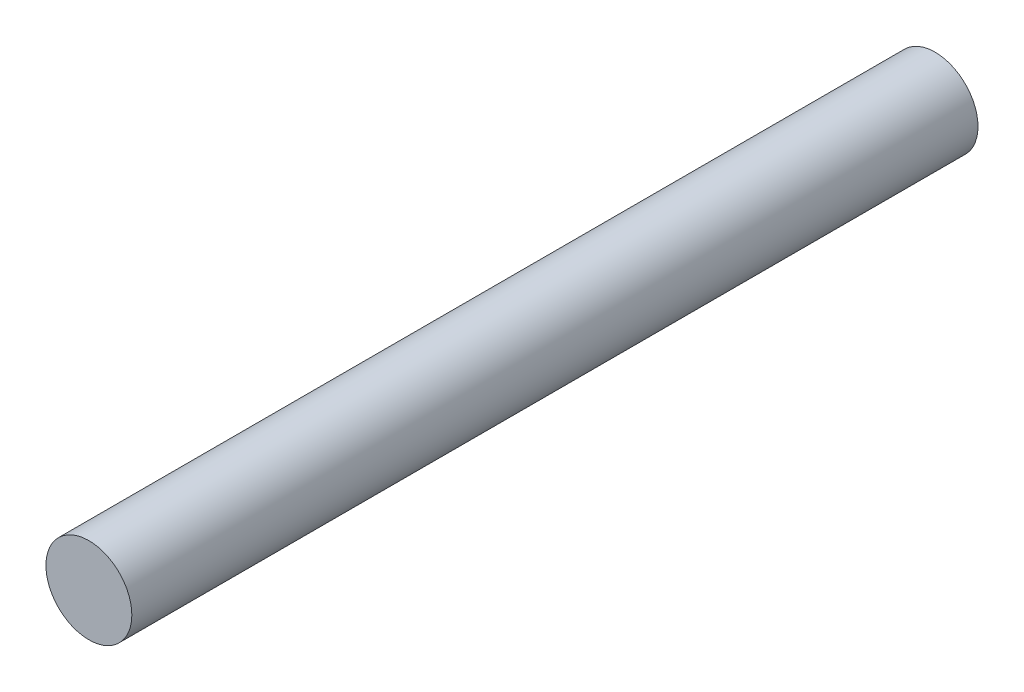
from build123d import *

# Parameters (mm, degrees)
SKETCH1_R           = 4.7625
BOSS_EXTRUDE1_DEPTH = 93.8022


with BuildPart() as part:
    # Sketch1 → Boss-Extrude1 (new body)
    with BuildSketch(Plane.XY):
        Circle(SKETCH1_R)
    extrude(amount=BOSS_EXTRUDE1_DEPTH)


solid = part.part
